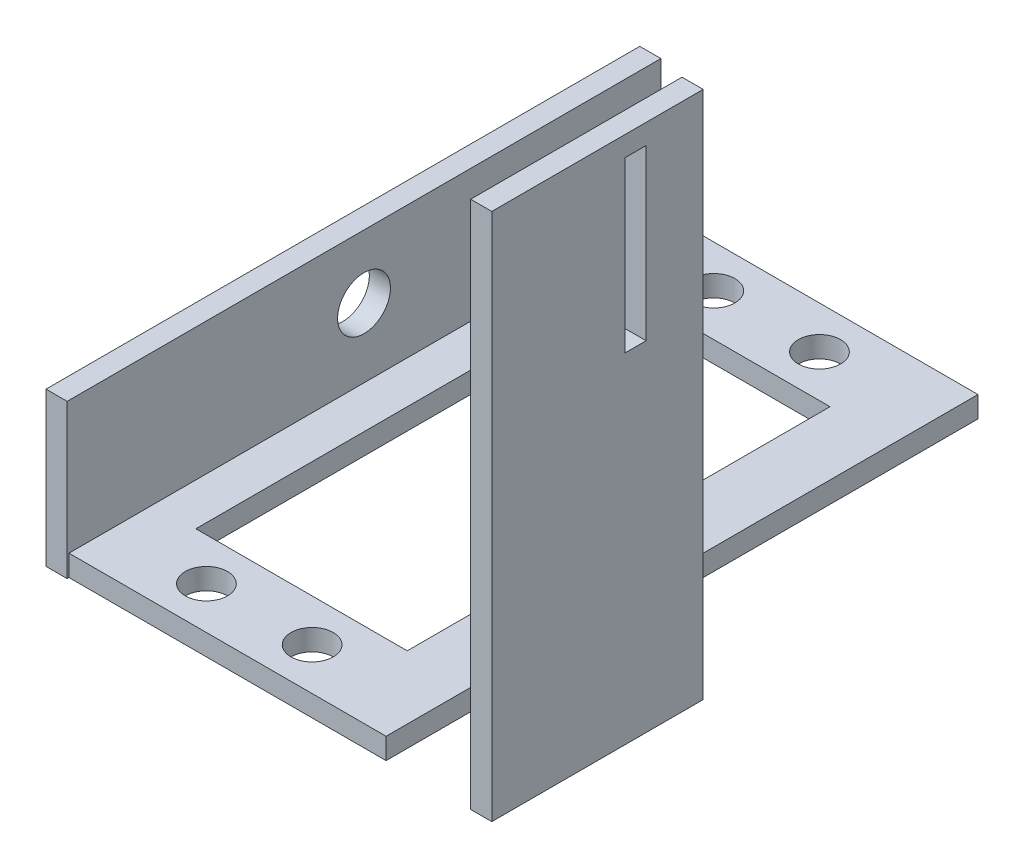
from build123d import *

# Parameters (mm, degrees)
SKETCH1_W             = 20
SKETCH1_H             = 8
SKETCH1_R             = 2
BOSS_EXTRUDE1_DEPTH   = 2
BOSS_EXTRUDE1_2_DEPTH = 2
SKETCH6_W             = 56
SKETCH6_H             = 2
BOSS_EXTRUDE5_DEPTH   = 6
SKETCH10_W            = 56
SKETCH10_H            = 2
BOSS_EXTRUDE7_DEPTH   = 4
SKETCH11_W            = 56.175194469
SKETCH11_H            = 14.528307745
BOSS_EXTRUDE8_DEPTH   = 2
SKETCH12_R            = 2.5
CUT_EXTRUDE3_DEPTH    = 2
SKETCH13_W            = 20
SKETCH13_H            = 50
SKETCH13_W_2          = 2
SKETCH13_H_2          = 16
BOSS_EXTRUDE9_DEPTH   = 2


with BuildPart() as part:
    # Sketch1 → Boss-Extrude1 (new body)
    with BuildSketch(Plane(origin=(0, 0, 0), x_dir=(1, 0, 0), z_dir=(0, 1, 0))):
        with Locations((-0.385906166, -15.501316712)):
            Rectangle(SKETCH1_W, SKETCH1_H)
        with Locations(Location((4.614093834, -15.501316712, 0), (0, 0, 270))):
            Circle(SKETCH1_R, mode=Mode.SUBTRACT)
        with Locations(Location((-5.385906166, -15.501316712, 0), (0, 0, 270))):
            Circle(SKETCH1_R, mode=Mode.SUBTRACT)
    extrude(amount=BOSS_EXTRUDE1_DEPTH)



with BuildPart() as body_2:
    # Sketch1 → Boss-Extrude1 2 (new body)
    with BuildSketch(Plane(origin=(0, 0, 0), x_dir=(1, 0, 0), z_dir=(0, 1, 0))):
        with Locations((-0.385906166, 32.498683288)):
            Rectangle(SKETCH1_W, SKETCH1_H)
        with Locations(Location((4.614093834, 32.498683288, 0), (0, 0, 270))):
            Circle(SKETCH1_R, mode=Mode.SUBTRACT)
        with Locations(Location((-5.385906166, 32.498683288, 0), (0, 0, 270))):
            Circle(SKETCH1_R, mode=Mode.SUBTRACT)
    extrude(amount=BOSS_EXTRUDE1_2_DEPTH)


with BuildPart() as part_1:
    add(part.part)

    add(body_2.part)  # Boss-Extrude5 merges body 2
    # Sketch6 → Boss-Extrude5 (add)
    with BuildSketch(Plane(origin=(9.614093834, 0, 0), x_dir=(0, 0, -1), z_dir=(1, 0, 0))):
        with Locations((8.498683288, 1)):
            Rectangle(SKETCH6_W, SKETCH6_H)
    extrude(amount=BOSS_EXTRUDE5_DEPTH)

    # Sketch10 → Boss-Extrude7 (add)
    with BuildSketch(Plane.ZY.offset(10.385906166)):
        with Locations((-8.498683288, 1)):
            Rectangle(SKETCH10_W, SKETCH10_H)
    extrude(amount=BOSS_EXTRUDE7_DEPTH)

    # Sketch11 → Boss-Extrude8 (add)
    with BuildSketch(Plane.ZY.offset(14.385906166)):
        with Locations((-8.411086054, 7.264153873)):
            Rectangle(SKETCH11_W, SKETCH11_H)
    extrude(amount=BOSS_EXTRUDE8_DEPTH)

    # Sketch12 → Cut-Extrude3 (cut)
    with BuildSketch(Plane.ZY.offset(16.385906166)):
        with Locations((-8.411086053, 8.528307745)):
            Circle(SKETCH12_R)
    extrude(amount=-CUT_EXTRUDE3_DEPTH, mode=Mode.SUBTRACT)

    # Sketch13 → Boss-Extrude9 (add)
    with BuildSketch(Plane(origin=(15.614093834, 0, 0), x_dir=(0, 0, -1), z_dir=(1, 0, 0))):
        with Locations((-1.501316712, 17)):
            Rectangle(SKETCH13_W, SKETCH13_H)
        with Locations((2.10225409, 32.102958265)):
            Rectangle(SKETCH13_W_2, SKETCH13_H_2, mode=Mode.SUBTRACT)
    extrude(amount=BOSS_EXTRUDE9_DEPTH)


solid = part_1.part
